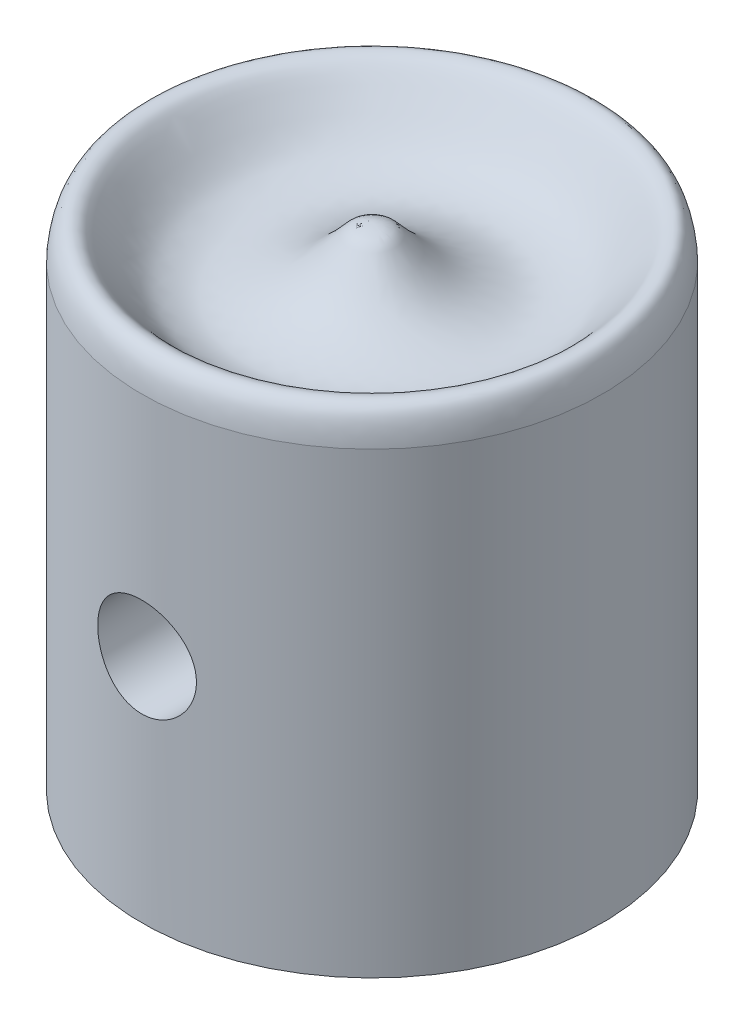
from build123d import *

# Parameters (mm, degrees)
CUT_EXTRUDE1_DEPTH      = 14.866731381
CUT_EXTRUDE1_DEPTH_BACK = 14.866731381
SKETCH2_R               = 1.5
SCALE1_SCALE            = 1.5


with BuildPart() as part:
    # Sketch1 → Revolve1 (revolve)
    with BuildSketch(Plane.XY, mode=Mode.PRIVATE) as revolve1_sk:
        with BuildLine():
            Line((-7, 8.712098042), (-7, 7.295703465))
            Line((-7, 7.295703465), (-7, 6.795703465))
            Line((-7, 6.795703465), (-7, 6.295703465))
            Line((-7, 6.295703465), (-7, 5.795703465))
            Line((-7, 5.795703465), (-7, -5.204296535))
            Line((-7, -5.204296535), (-6.25, -5.204296535))
            Line((-6.25, -5.204296535), (-5.050561785, -1.908867124))
            ThreePointArc((-5.050561785, -1.908867124), (-4.825715591, -1.069729704), (-4.75, -0.204296535))
            Line((-4.75, -0.204296535), (-4.75, 4.440083994))
            ThreePointArc((-4.75, 4.440083994), (-4.399873792, 5.550542455), (-3.476134386, 6.259352631))
            Line((-3.476134386, 6.259352631), (0, 7.524562078))
            Line((0, 7.524562078), (0, 8.566185983))
            Line((0, 8.566185983), (0, 9.69172121))
            add(Edge.make_bspline(
                [(-7, 8.712098042), (-6.915941705, 9.672888752), (-6.571850582, 9.786532429), (-6.017076444, 9.562037769), (-5.173496459, 8.320355176), (-3.929482137, 7.778040067), (-3.257853738, 7.770566701), (-1.62159895, 8.374478133), (-0.988089519, 9.078164836), (-0.514286955, 9.634062862), (-0.187546651, 9.695286605), (0, 9.69172121)],
                knots=[0, 0, 0, 0, 0.210746943, 0.254088111, 0.413486836, 0.459298403, 0.666392212, 0.714990212, 0.896680404, 0.92745251, 1, 1, 1, 1], degree=3))
        make_face()
    revolve(revolve1_sk.sketch.rotate(Axis((0, 2.420801252, 0), (0, 1, 0)), 270), axis=Axis((0, 2.420801252, 0), (0, 1, 0)))

    # Sketch2 → Cut-Extrude1 (cut, two sides: drawn at the far end of the back side and taken through both)
    with BuildSketch(Plane.XY.offset(-CUT_EXTRUDE1_DEPTH_BACK)):
        with Locations((0, 1.795703465)):
            Circle(SKETCH2_R)
    extrude(amount=CUT_EXTRUDE1_DEPTH + CUT_EXTRUDE1_DEPTH_BACK, mode=Mode.SUBTRACT)


with BuildPart() as part_1:
    # Scale1: scaled about (-7.054e-06, 3.062618866, 0.000522171)
    add(part.part.scale(SCALE1_SCALE).moved(Location((3.527e-06, -1.531309433, -0.000261085))))


solid = part_1.part
